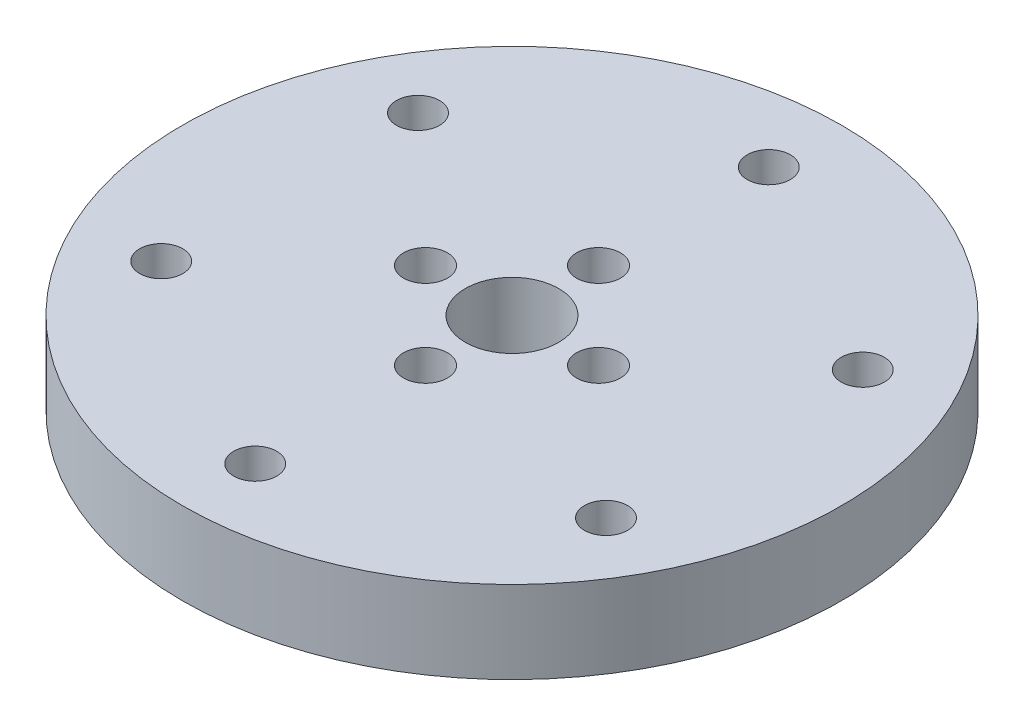
from build123d import *

# Parameters (mm, degrees)
SKETCH1_R           = 30.48
BOSS_EXTRUDE1_DEPTH = 7.62
SKETCH2_R           = 1.9939
CUT_EXTRUDE1_DEPTH  = 44.773567367
CIRPATTERN1_COUNT   = 6
SKETCH3_R           = 4.318
SKETCH3_R_2         = 2.032
CUT_EXTRUDE2_DEPTH  = 44.773567367
CIRPATTERN2_COUNT   = 4


with BuildPart() as part:
    # Sketch1 → Boss-Extrude1 (new body)
    with BuildSketch(Plane(origin=(0, 0, 0), x_dir=(1, 0, 0), z_dir=(0, 1, 0))):
        with Locations(Location((0, 0, 0), (0, 0, 90))):
            Circle(SKETCH1_R)
    extrude(amount=BOSS_EXTRUDE1_DEPTH)

    # Sketch2 → Cut-Extrude1 (cut, through all)
    with BuildSketch(Plane(origin=(0, 7.62, 0), x_dir=(1, 0, 0), z_dir=(0, 1, 0))):
        with Locations(Location((0, -23.749, 0), (0, 0, 270))):
            Circle(SKETCH2_R)
    cut_extrude1 = extrude(amount=-CUT_EXTRUDE1_DEPTH, mode=Mode.SUBTRACT)

    # CirPattern1: Cut-Extrude1 ×6 about axis
    cirpattern1_axis = Axis((0, 0, 0), (0, 1, 0))
    for i in range(1, CIRPATTERN1_COUNT):
        add(cut_extrude1.rotate(cirpattern1_axis, i * 360 / CIRPATTERN1_COUNT), mode=Mode.SUBTRACT)

    # Sketch3 → Cut-Extrude2 (cut, through all)
    with BuildSketch(Plane(origin=(0, 7.62, 0), x_dir=(1, 0, 0), z_dir=(0, 1, 0))):
        with Locations(Location((0, 0, 0), (0, 0, 270))):
            Circle(SKETCH3_R)
        with Locations(Location((0, -8.001, 0), (0, 0, 270))):
            Circle(SKETCH3_R_2)
    cut_extrude2 = extrude(amount=-CUT_EXTRUDE2_DEPTH, mode=Mode.SUBTRACT)

    # CirPattern2: Cut-Extrude2 ×4 about axis
    cirpattern2_axis = Axis((0, 0, 0), (0, 1, 0))
    for i in range(1, CIRPATTERN2_COUNT):
        add(cut_extrude2.rotate(cirpattern2_axis, i * 360 / CIRPATTERN2_COUNT), mode=Mode.SUBTRACT)


solid = part.part
